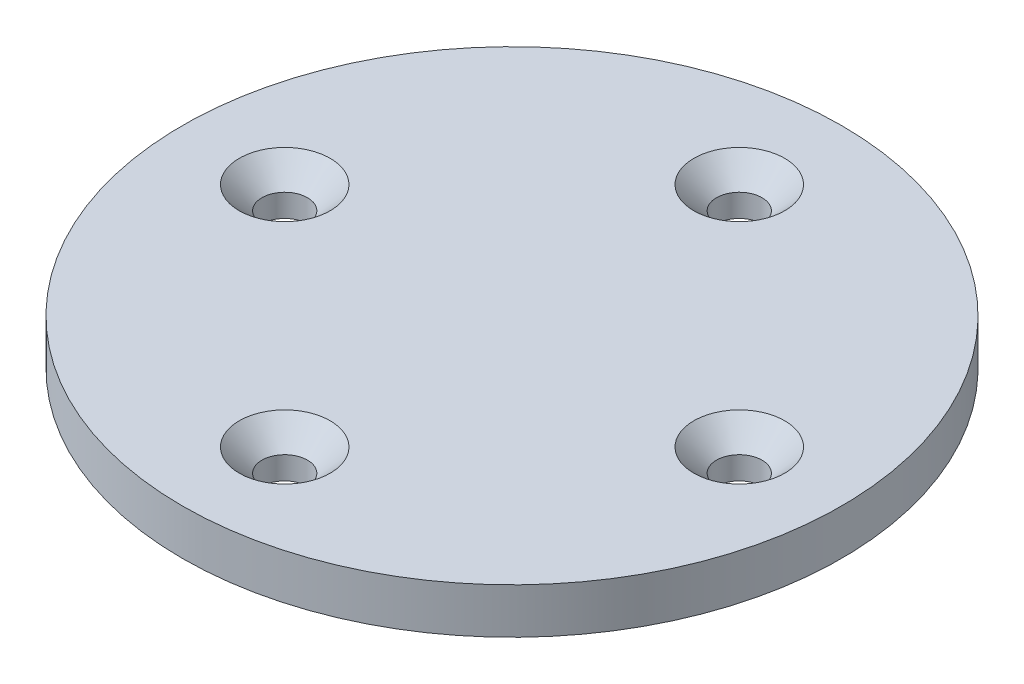
from build123d import *

# Parameters (mm, degrees)
SKETCH1_R                 = 14.5
BOSS_EXTRUDE1_DEPTH       = 2
F_2_0MM_DOWEL_HOLE1_D     = 2
F_2_0MM_DOWEL_HOLE1_DEPTH = 42.93
F_2_0MM_DOWEL_HOLE1_TIP   = 0.600860619
CHAMFER1_SIZE             = 1


with BuildPart() as part:
    # Sketch1 → Boss-Extrude1 (new body)
    with BuildSketch(Plane(origin=(0, 0, 0), x_dir=(1, 0, 0), z_dir=(0, 1, 0))):
        with Locations(Location((0, 0, 0), (0, 0, 270))):
            Circle(SKETCH1_R)
    extrude(amount=BOSS_EXTRUDE1_DEPTH)

    # Ø2.0mm Dowel Hole1
    with Locations(Plane(origin=(0, 2, 0), x_dir=(1, 0, 0), z_dir=(0, 1, 0))):
        with Locations((-10, 0), (0, 10), (10, 0), (0, -10)):
            Hole(F_2_0MM_DOWEL_HOLE1_D / 2, depth=F_2_0MM_DOWEL_HOLE1_DEPTH)
            with Locations((0, 0, -(F_2_0MM_DOWEL_HOLE1_DEPTH + F_2_0MM_DOWEL_HOLE1_TIP / 2))):  # 118° drill point
                Cone(0, F_2_0MM_DOWEL_HOLE1_D / 2, F_2_0MM_DOWEL_HOLE1_TIP, mode=Mode.SUBTRACT)

    # Chamfer1
    chamfer1_edges = [part.edges().sort_by_distance(p)[0] for p in [
        (1, 2, 10),
        (11, 2, 0),
        (1, 2, -10),
        (-9, 2, 0),
    ]]
    chamfer(chamfer1_edges, length=CHAMFER1_SIZE)


solid = part.part
